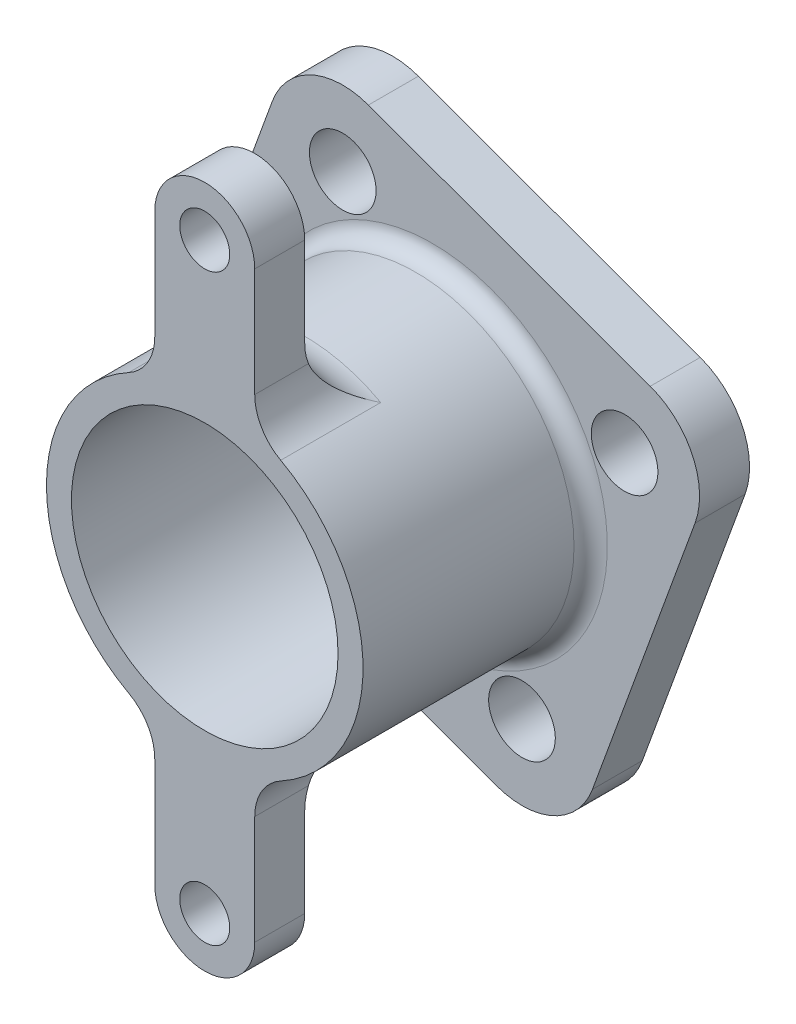
from build123d import *

# Parameters (mm, degrees)
SKETCH1_R           = 8
SKETCH1_R_2         = 2
BOSS_EXTRUDE1_DEPTH = 3
SKETCH2_R           = 9.5
SKETCH2_R_2         = 8
BOSS_EXTRUDE2_DEPTH = 16.66
BOSS_EXTRUDE3_START = -3
SKETCH3_R           = 1.5
BOSS_EXTRUDE3_DEPTH = 3
FILLET1_R           = 3
FILLET2_R           = 1


with BuildPart() as part:
    # Sketch1 → Boss-Extrude1 (new body)
    with BuildSketch(Plane.XY):
        with BuildLine():
            Line((-20.074505522, -9.607669091), (-3.160038348, -15.764031671))
            ThreePointArc((-3.160038348, -15.764031671), (0.280834475, -15.613799919), (2.607669091, -13.074505522))
            Line((2.607669091, -13.074505522), (8.764031671, 3.839961652))
            ThreePointArc((8.764031671, 3.839961652), (8.613799919, 7.280834475), (6.074505522, 9.607669091))
            Line((6.074505522, 9.607669091), (-10.839961652, 15.764031671))
            ThreePointArc((-10.839961652, 15.764031671), (-14.280834475, 15.613799919), (-16.607669091, 13.074505522))
            Line((-16.607669091, 13.074505522), (-22.764031671, -3.839961652))
            ThreePointArc((-22.764031671, -3.839961652), (-22.613799919, -7.280834475), (-20.074505522, -9.607669091))
        make_face()
        with Locations((-7, 0)):
            Circle(SKETCH1_R, mode=Mode.SUBTRACT)
        with Locations((-12.379052297, 11.535414877)):
            Circle(SKETCH1_R_2, mode=Mode.SUBTRACT)
        with Locations((4.535414877, 5.379052297)):
            Circle(SKETCH1_R_2, mode=Mode.SUBTRACT)
        with Locations((-1.620947703, -11.535414877)):
            Circle(SKETCH1_R_2, mode=Mode.SUBTRACT)
        with Locations((-18.535414877, -5.379052297)):
            Circle(SKETCH1_R_2, mode=Mode.SUBTRACT)
    extrude(amount=BOSS_EXTRUDE1_DEPTH)

    # Sketch2 → Boss-Extrude2 (add)
    with BuildSketch(Plane.XY):
        with Locations(Location((-7, 0, 0), (0, 0, 180))):
            Circle(SKETCH2_R)
        with Locations((-7, 0)):
            Circle(SKETCH2_R_2, mode=Mode.SUBTRACT)
    extrude(amount=BOSS_EXTRUDE2_DEPTH)

    # Sketch3 → Boss-Extrude3 (add)
    # profile 1 of 2: a face of its own
    with BuildSketch(Plane.XY.offset(16.66).offset(BOSS_EXTRUDE3_START)):
        with BuildLine():
            Line((-4, 9.013878189), (-4, 17.5))
            ThreePointArc((-4, 17.5), (-7, 20.5), (-10, 17.5))
            Line((-10, 17.5), (-10, 9.013878189))
            ThreePointArc((-10, 9.013878189), (-7, 9.5), (-4, 9.013878189))
        make_face()
        with Locations((-7, 17.5)):
            Circle(SKETCH3_R, mode=Mode.SUBTRACT)
    # profile 2 of 2: a face of its own
    with BuildSketch(Plane.XY.offset(16.66).offset(BOSS_EXTRUDE3_START)):
        with BuildLine():
            Line((-10, -9.013878189), (-10, -17.5))
            ThreePointArc((-10, -17.5), (-7, -20.5), (-4, -17.5))
            Line((-4, -17.5), (-4, -9.013878189))
            ThreePointArc((-4, -9.013878189), (-7, -9.5), (-10, -9.013878189))
        make_face()
        with Locations((-7, -17.5)):
            Circle(SKETCH3_R, mode=Mode.SUBTRACT)
    extrude(amount=BOSS_EXTRUDE3_DEPTH)

    # Fillet1
    fillet1_edges = [part.edges().sort_by_distance(p)[0] for p in [
        (-10, -9.013878189, 15.16),
        (-4, -9.013878189, 15.16),
        (-7, -9.5, 13.66),
        (-4, 9.013878189, 15.16),
        (-10, 9.013878189, 15.16),
        (-7, 9.5, 13.66),
    ]]
    fillet(fillet1_edges, radius=FILLET1_R)

    # Fillet2
    fillet2_edges = [part.edges().sort_by_distance(p)[0] for p in [
        (2.5, 0, 3),
    ]]
    fillet(fillet2_edges, radius=FILLET2_R)


solid = part.part
